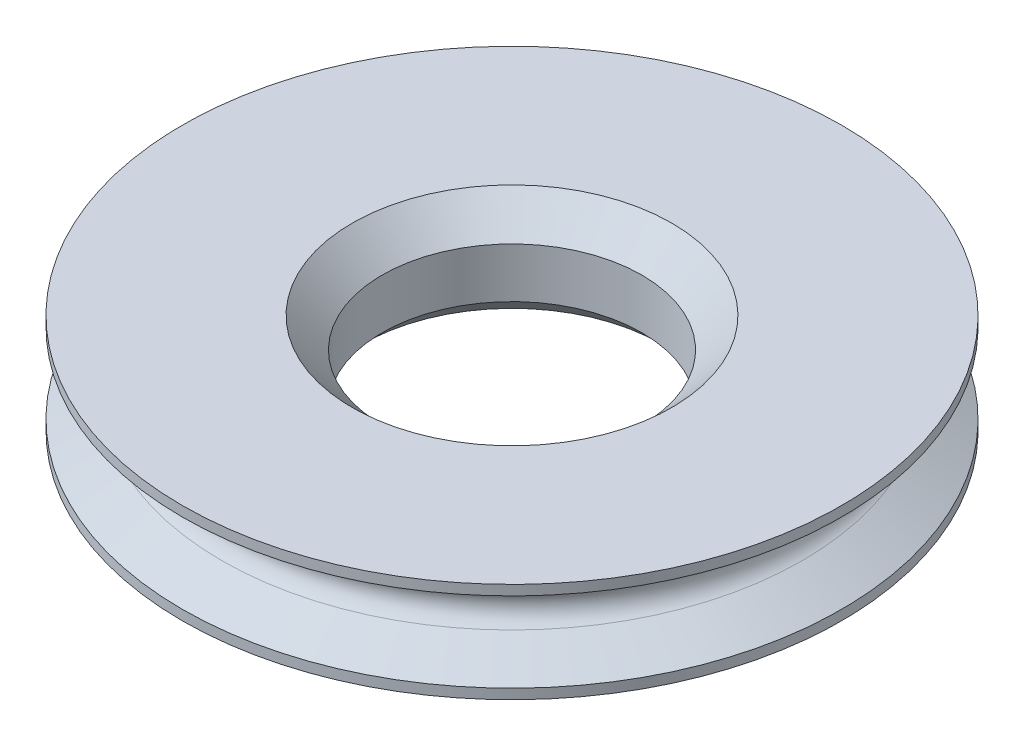
from build123d import *


with BuildPart() as part:
    # Sketch1 → Revolve3 (revolve)
    with BuildSketch(Plane.XY, mode=Mode.PRIVATE) as revolve3_sk:
        with BuildLine():
            Line((0, 0), (22.86, 0))
            Line((22.86, 0), (25.4, 2.54))
            Line((25.4, 2.54), (25.4, 8.89))
            Line((25.4, 8.89), (21.59, 12.7))
            Line((21.59, 12.7), (0, 12.7))
            Line((0, 12.7), (0, 11.43))
            Line((0, 11.43), (4.988818102, 8.549704526))
            ThreePointArc((4.988818102, 8.549704526), (6.258818102, 6.35), (4.988818102, 4.150295474))
            Line((4.988818102, 4.150295474), (0, 1.27))
            Line((0, 1.27), (0, 0))
        make_face()
    revolve(revolve3_sk.sketch.rotate(Axis((41.91, 0, 0), (0, 1, 0)), 270), axis=Axis((41.91, 0, 0), (0, 1, 0)))


solid = part.part
